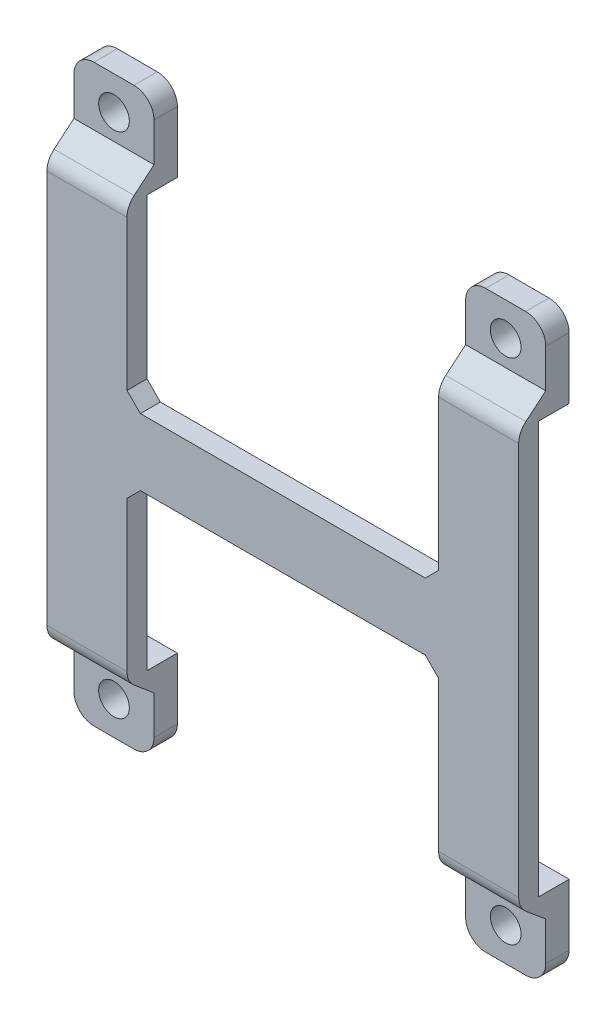
from build123d import *

# Parameters (mm, degrees)
BOSS_EXTRUDE1_DEPTH      = 3
BOSS_EXTRUDE1_DEPTH_BACK = 4.55
SKETCH1_W                = 12
SKETCH1_H                = 10
SKETCH1_R                = 2.3
SKETCH1_H_2              = 28.075
SKETCH1_W_2              = 46.7
SKETCH5_W                = 12
SKETCH5_H                = 25.875
SKETCH5_H_2              = 10
SKETCH5_H_3              = 25.866
SKETCH5_W_2              = 46.7
CUT_EXTRUDE1_DEPTH       = 4.55
CUT_EXTRUDE2_DEPTH       = 87.014737759
CHAMFER1_SIZE            = 2
FILLET1_R                = 3
FILLET2_R                = 3


with BuildPart() as part:
    # Sketch1 → Boss-Extrude1 (new, two sides: drawn at the far end of the back side and taken through both)
    # profile 1 of 11: a face of its own
    with BuildSketch(Plane.XY.offset(-BOSS_EXTRUDE1_DEPTH_BACK)):
        with Locations((-38.872559152, 32.371494367)):
            Rectangle(SKETCH1_W, SKETCH1_H)
        with Locations((-38.872559152, 32.371494367)):
            Circle(SKETCH1_R, mode=Mode.SUBTRACT)
    # profile 2 of 11: a face of its own
    with BuildSketch(Plane.XY.offset(-BOSS_EXTRUDE1_DEPTH_BACK)):
        with Locations((-38.872559152, 13.333994367)):
            Rectangle(SKETCH1_W, SKETCH1_H_2)
    # profile 3 of 11: a face of its own
    with BuildSketch(Plane.XY.offset(-BOSS_EXTRUDE1_DEPTH_BACK)):
        with Locations((-38.872559152, -5.703505633)):
            Rectangle(SKETCH1_W, SKETCH1_H)
    # profile 4 of 11: a face of its own
    with BuildSketch(Plane.XY.offset(-BOSS_EXTRUDE1_DEPTH_BACK)):
        with Locations((-38.872559152, -24.741005633)):
            Rectangle(SKETCH1_W, SKETCH1_H_2)
    # profile 5 of 11: a face of its own
    with BuildSketch(Plane.XY.offset(-BOSS_EXTRUDE1_DEPTH_BACK)):
        with Locations((-38.872559152, -43.778505633)):
            Rectangle(SKETCH1_W, SKETCH1_H)
        with Locations((-38.872559152, -43.778505633)):
            Circle(SKETCH1_R, mode=Mode.SUBTRACT)
    # profile 6 of 11: a face of its own
    with BuildSketch(Plane.XY.offset(-BOSS_EXTRUDE1_DEPTH_BACK)):
        with Locations((19.827440848, -24.741005633)):
            Rectangle(SKETCH1_W, SKETCH1_H_2)
    # profile 7 of 11: a face of its own
    with BuildSketch(Plane.XY.offset(-BOSS_EXTRUDE1_DEPTH_BACK)):
        with Locations((19.827440848, -43.778505633)):
            Rectangle(SKETCH1_W, SKETCH1_H)
        with Locations((19.827440848, -43.778505633)):
            Circle(SKETCH1_R, mode=Mode.SUBTRACT)
    # profile 8 of 11: a face of its own
    with BuildSketch(Plane.XY.offset(-BOSS_EXTRUDE1_DEPTH_BACK)):
        with Locations((19.827440848, -5.703505633)):
            Rectangle(SKETCH1_W, SKETCH1_H)
    # profile 9 of 11: a face of its own
    with BuildSketch(Plane.XY.offset(-BOSS_EXTRUDE1_DEPTH_BACK)):
        with Locations((-9.522559152, -5.703505633)):
            Rectangle(SKETCH1_W_2, SKETCH1_H)
    # profile 10 of 11: a face of its own
    with BuildSketch(Plane.XY.offset(-BOSS_EXTRUDE1_DEPTH_BACK)):
        with Locations((19.827440848, 13.333994367)):
            Rectangle(SKETCH1_W, SKETCH1_H_2)
    # profile 11 of 11: a face of its own
    with BuildSketch(Plane.XY.offset(-BOSS_EXTRUDE1_DEPTH_BACK)):
        with Locations((19.827440848, 32.371494367)):
            Rectangle(SKETCH1_W, SKETCH1_H)
        with Locations((19.827440848, 32.371494367)):
            Circle(SKETCH1_R, mode=Mode.SUBTRACT)
    extrude(amount=BOSS_EXTRUDE1_DEPTH + BOSS_EXTRUDE1_DEPTH_BACK)

    # Sketch5 → Cut-Extrude1 (cut)
    with BuildSketch(Plane(origin=(0, 0, -4.55), x_dir=(-1, 0, 0), z_dir=(0, 0, -1))):
        with Locations((-19.827440848, 12.233994367)):
            Rectangle(SKETCH5_W, SKETCH5_H)
        with Locations((-19.827440848, -5.703505633)):
            Rectangle(SKETCH5_W, SKETCH5_H_2)
        with Locations((-19.827440848, -23.636505633)):
            Rectangle(SKETCH5_W, SKETCH5_H_3)
        with Locations((9.522559152, -5.703505633)):
            Rectangle(SKETCH5_W_2, SKETCH5_H_2)
        with Locations((38.872559152, -5.703505633)):
            Rectangle(SKETCH5_W, SKETCH5_H_2)
        with Locations((38.872559152, -23.636505633)):
            Rectangle(SKETCH5_W, SKETCH5_H_3)
        with Locations((38.872559152, 12.233994367)):
            Rectangle(SKETCH5_W, SKETCH5_H)
    extrude(amount=-CUT_EXTRUDE1_DEPTH, mode=Mode.SUBTRACT)

    # Sketch6 → Cut-Extrude2 (cut, through all)
    with BuildSketch(Plane.ZY.offset(44.872559152)):
        Polygon((-1.05, 28.569847873), (3, 25.171494367), (3, 37.371494367), (-1.05, 37.371494367), align=None)
        Polygon((-1.05, -48.778505633), (3, -48.778505633), (3, -36.578505633), (-1.05, -39.976859139), align=None)
    extrude(amount=-CUT_EXTRUDE2_DEPTH, mode=Mode.SUBTRACT)

    # Chamfer1
    chamfer1_edges = [part.edges().sort_by_distance(p)[0] for p in [
        (-32.872559152, -10.703505633, 1.5),
        (13.827440848, -10.703505633, 1.5),
        (13.827440848, -0.703505633, 1.5),
        (-32.872559152, -0.703505633, 1.5),
    ]]
    chamfer(chamfer1_edges, length=CHAMFER1_SIZE)

    # Fillet1
    fillet1_edges = [part.edges().sort_by_distance(p)[0] for p in [
        (13.827440848, 37.371494367, -2.8),
        (25.827440848, 37.371494367, -2.8),
        (25.827440848, -48.778505633, -2.8),
        (13.827440848, -48.778505633, -2.8),
        (-32.872559152, -48.778505633, -2.8),
        (-44.872559152, -48.778505633, -2.8),
        (-44.872559152, 37.371494367, -2.8),
        (-32.872559152, 37.371494367, -2.8),
    ]]
    fillet(fillet1_edges, radius=FILLET1_R)

    # Fillet2
    fillet2_edges = [part.edges().sort_by_distance(p)[0] for p in [
        (-38.872559152, -36.578505633, 3),
        (-38.872559152, 25.171494367, 3),
        (19.827440848, 25.171494367, 3),
        (19.827440848, -36.578505633, 3),
    ]]
    fillet(fillet2_edges, radius=FILLET2_R)


solid = part.part
